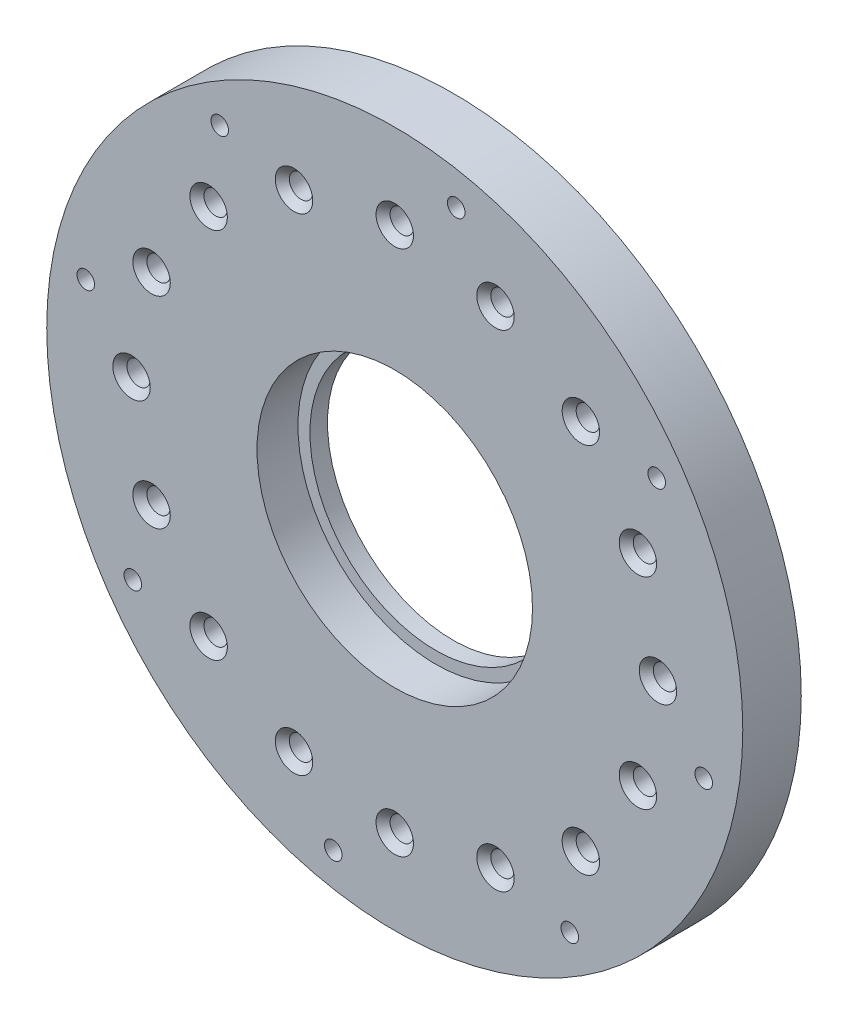
from build123d import *

# Parameters (mm, degrees)
SKETCH3_R           = 59.5
BOSS_EXTRUDE1_DEPTH = 10
SKETCH4_R           = 1.5
CUT_EXTRUDE1_DEPTH  = 85.737830985
SKETCH5_R           = 2
CUT_EXTRUDE2_DEPTH  = 5
SKETCH6_R           = 2.9
CUT_EXTRUDE3_DEPTH  = 3
SKETCH7_R           = 23.55
CUT_EXTRUDE4_DEPTH  = 7
SKETCH8_R           = 21.5
CUT_EXTRUDE5_DEPTH  = 85.737830985
CHAMFER1_SIZE       = 1.2


with BuildPart() as part:
    # Sketch3 → Boss-Extrude1 (new body)
    with BuildSketch(Plane.XY):
        Circle(SKETCH3_R)
    extrude(amount=BOSS_EXTRUDE1_DEPTH)

    # Sketch4 → Cut-Extrude1 (cut, through all)
    with BuildSketch(Plane.XY.offset(10)):
        with Locations((44.782953319, 29.92301275)):
            Circle(SKETCH4_R)
        with Locations((52.825095203, -10.507564744)):
            Circle(SKETCH4_R)
        with Locations((29.92301275, -44.782953319)):
            Circle(SKETCH4_R)
        with Locations((-10.507564744, -52.825095203)):
            Circle(SKETCH4_R)
        with Locations((-44.782953319, -29.92301275)):
            Circle(SKETCH4_R)
        with Locations((-52.825095203, 10.507564744)):
            Circle(SKETCH4_R)
        with Locations((-29.92301275, 44.782953319)):
            Circle(SKETCH4_R)
        with Locations((10.507564744, 52.825095203)):
            Circle(SKETCH4_R)
    extrude(amount=-CUT_EXTRUDE1_DEPTH, mode=Mode.SUBTRACT)

    # Sketch5 → Cut-Extrude2 (cut)
    with BuildSketch(Plane.XY.offset(10)):
        with Locations((45, 0)):
            Circle(SKETCH5_R)
        with Locations((41.574578963, -17.220754456)):
            Circle(SKETCH5_R)
        with Locations((31.819805153, -31.819805153)):
            Circle(SKETCH5_R)
        with Locations((17.220754456, -41.574578963)):
            Circle(SKETCH5_R)
        with Locations((0, -45)):
            Circle(SKETCH5_R)
        with Locations((-17.220754456, -41.574578963)):
            Circle(SKETCH5_R)
        with Locations((-31.819805153, -31.819805153)):
            Circle(SKETCH5_R)
        with Locations((-41.574578963, -17.220754456)):
            Circle(SKETCH5_R)
        with Locations((-45, 0)):
            Circle(SKETCH5_R)
        with Locations((-41.574578963, 17.220754456)):
            Circle(SKETCH5_R)
        with Locations((-31.819805153, 31.819805153)):
            Circle(SKETCH5_R)
        with Locations((-17.220754456, 41.574578963)):
            Circle(SKETCH5_R)
        with Locations((0, 45)):
            Circle(SKETCH5_R)
        with Locations((17.220754456, 41.574578963)):
            Circle(SKETCH5_R)
        with Locations((31.819805153, 31.819805153)):
            Circle(SKETCH5_R)
        with Locations((41.574578963, 17.220754456)):
            Circle(SKETCH5_R)
    extrude(amount=-CUT_EXTRUDE2_DEPTH, mode=Mode.SUBTRACT)

    # Sketch6 → Cut-Extrude3 (cut)
    with BuildSketch(Plane(origin=(0, 0, 0), x_dir=(-1, 0, 0), z_dir=(0, 0, -1))):
        with Locations((52.825095203, 10.507564744)):
            Circle(SKETCH6_R)
        with Locations((44.782953319, -29.92301275)):
            Circle(SKETCH6_R)
        with Locations((10.507564744, -52.825095203)):
            Circle(SKETCH6_R)
        with Locations((-29.92301275, -44.782953319)):
            Circle(SKETCH6_R)
        with Locations((-52.825095203, -10.507564744)):
            Circle(SKETCH6_R)
        with Locations((-44.782953319, 29.92301275)):
            Circle(SKETCH6_R)
        with Locations((-10.507564744, 52.825095203)):
            Circle(SKETCH6_R)
        with Locations((29.92301275, 44.782953319)):
            Circle(SKETCH6_R)
    extrude(amount=-CUT_EXTRUDE3_DEPTH, mode=Mode.SUBTRACT)

    # Sketch7 → Cut-Extrude4 (cut)
    with BuildSketch(Plane.XY.offset(10)):
        Circle(SKETCH7_R)
    extrude(amount=-CUT_EXTRUDE4_DEPTH, mode=Mode.SUBTRACT)

    # Sketch8 → Cut-Extrude5 (cut, through all)
    with BuildSketch(Plane.XY.offset(10)):
        Circle(SKETCH8_R)
    extrude(amount=-CUT_EXTRUDE5_DEPTH, mode=Mode.SUBTRACT)

    # Chamfer1
    chamfer1_edges = [part.edges().sort_by_distance(p)[0] for p in [
        (39.574578963, 17.220754456, 10),
        (29.819805153, 31.819805153, 10),
        (15.220754456, 41.574578963, 10),
        (-2, 45, 10),
        (-19.220754456, 41.574578963, 10),
        (-33.819805153, 31.819805153, 10),
        (-43.574578963, 17.220754456, 10),
        (-47, 0, 10),
        (-43.574578963, -17.220754456, 10),
        (-33.819805153, -31.819805153, 10),
        (-19.220754456, -41.574578963, 10),
        (-2, -45, 10),
        (15.220754456, -41.574578963, 10),
        (29.819805153, -31.819805153, 10),
        (39.574578963, -17.220754456, 10),
        (43, 0, 10),
    ]]
    chamfer(chamfer1_edges, length=CHAMFER1_SIZE)


solid = part.part
